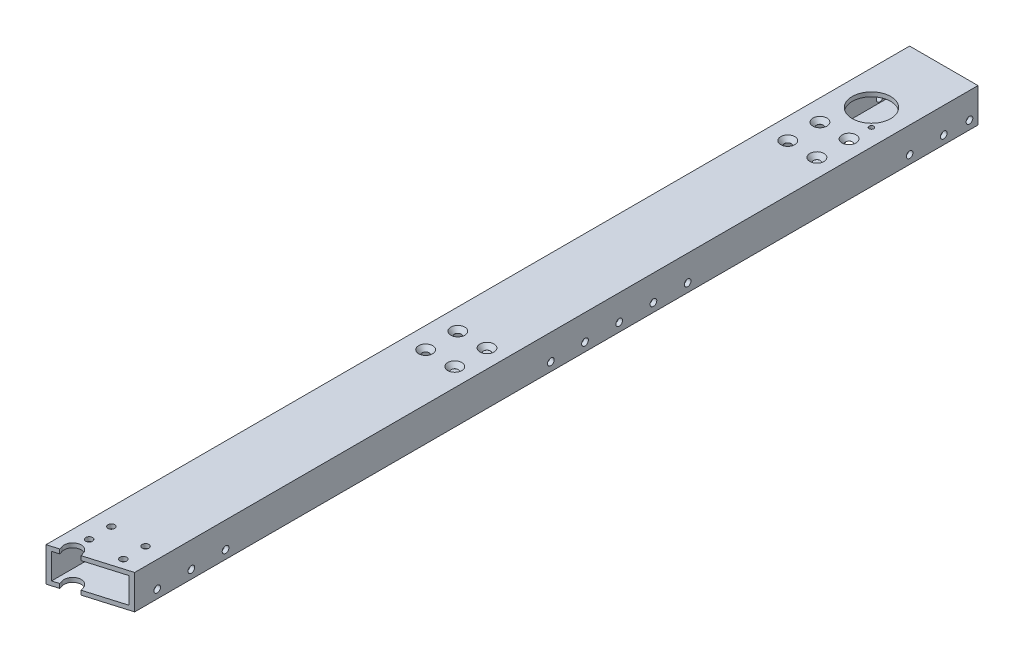
from build123d import *

# Parameters (mm, degrees)
BOSS_EXTRUDE1_DEPTH              = 320.675
BOSS_EXTRUDE1_DEPTH_BACK         = 320.675
SKETCH3_W                        = 50.8
SKETCH3_H                        = 25.4
SKETCH3_W_2                      = 44.45
SKETCH3_H_2                      = 19.05
CUT_EXTRUDE1_DEPTH               = 323.680609311
CUT_EXTRUDE1_DEPTH_BACK          = 323.680609311
SKETCH8_R                        = 14.2875
CUT_EXTRUDE2_DEPTH               = 323.680609311
F_10_CLEARANCE_HOLE1_D           = 4.9784
F_10_CLEARANCE_HOLE1_DEPTH       = 5.08
F_10_CLEARANCE_HOLE1_TIP         = 1.495662253
F_10_CLEARANCE_HOLE2_D           = 4.9784
F_10_CLEARANCE_HOLE3_D           = 4.9784
TAP_DRILL_FOR_8_32_TAP1_D        = 3.4544
F_10_CLEARANCE_HOLE4_AT_2_COUNT  = 2
F_10_CLEARANCE_HOLE4_AT_2_PITCH  = 21.6408
F_10_CLEARANCE_HOLE4_AT_3_COUNT  = 2
F_10_CLEARANCE_HOLE4_AT_3_PITCH  = 32.224022105
F_10_CLEARANCE_HOLE4_AT_4_COUNT  = 2
F_10_CLEARANCE_HOLE4_AT_4_PITCH  = 23.876
F_10_CLEARANCE_HOLE4_AT_5_COUNT  = 2
F_10_CLEARANCE_HOLE4_AT_5_PITCH  = 245.0465
F_10_CLEARANCE_HOLE4_AT_6_COUNT  = 2
F_10_CLEARANCE_HOLE4_AT_6_PITCH  = 246.000226396
F_10_CLEARANCE_HOLE4_AT_7_COUNT  = 2
F_10_CLEARANCE_HOLE4_AT_7_PITCH  = 268.9225
F_10_CLEARANCE_HOLE4_AT_8_COUNT  = 2
F_10_CLEARANCE_HOLE4_AT_8_PITCH  = 269.79183685
F_10_0_1935_DIAMETER_HOLE1_D     = 4.9149
F_10_0_1935_DIAMETER_HOLE1_DEPTH = 3.302
F_10_0_1935_DIAMETER_HOLE1_TIP   = 1.476584928
CUT_EXTRUDE3_DEPTH               = 323.680609311


with BuildPart() as part:
    # Sketch3 → Boss-Extrude1 (new, two sides: drawn at the far end of the back side and taken through both)
    with BuildSketch(Plane.XY.offset(-BOSS_EXTRUDE1_DEPTH_BACK)):
        Rectangle(SKETCH3_W, SKETCH3_H)
        Rectangle(SKETCH3_W_2, SKETCH3_H_2, mode=Mode.SUBTRACT)
    extrude(amount=BOSS_EXTRUDE1_DEPTH + BOSS_EXTRUDE1_DEPTH_BACK)

    # Sketch4 → Cut-Extrude1 (cut, two sides: drawn at the far end of the back side and taken through both)
    with BuildSketch(Plane(origin=(0, 12.7, 0), x_dir=(1, 0, 0), z_dir=(0, 1, 0)).offset(-CUT_EXTRUDE1_DEPTH_BACK)):
        Polygon((1322.117470931, -320.675), (25.4, -320.675), (-25.4, -320.675), (25.4, -305.627354456), (1268.718301677, 62.660305034), (3837.350959621, 420.474595165), (3890.750128875, 37.139290131), align=None)
    extrude(amount=CUT_EXTRUDE1_DEPTH + CUT_EXTRUDE1_DEPTH_BACK, mode=Mode.SUBTRACT)

    # Sketch8 → Cut-Extrude2 (cut, through all)
    with BuildSketch(Plane(origin=(0, 12.7, 0), x_dir=(1, 0, 0), z_dir=(0, 1, 0))):
        with Locations(Location((0, 266.954, 0), (0, 0, 180))):
            Circle(SKETCH8_R)
    extrude(amount=-CUT_EXTRUDE2_DEPTH, mode=Mode.SUBTRACT)

    # #10 Clearance Hole1
    with Locations(Plane(origin=(0, 12.7, 0), x_dir=(1, 0, 0), z_dir=(0, 1, 0))):
        with Locations((-12.7762, -284.753033923), (12.6238, -284.753033923), (12.6238, -301.263033923), (-12.7762, -301.263033923)):
            Hole(F_10_CLEARANCE_HOLE1_D / 2, depth=F_10_CLEARANCE_HOLE1_DEPTH)
            with Locations((0, 0, -(F_10_CLEARANCE_HOLE1_DEPTH + F_10_CLEARANCE_HOLE1_TIP / 2))):  # 118° drill point
                Cone(0, F_10_CLEARANCE_HOLE1_D / 2, F_10_CLEARANCE_HOLE1_TIP, mode=Mode.SUBTRACT)

    # #10 Clearance Hole2 (through all)
    with Locations(Plane(origin=(25.4, 0, 0), x_dir=(0, 0, -1), z_dir=(1, 0, 0))):
        with Locations((3.429, -6.35), (28.829, -6.35), (54.229, -6.35), (79.629, -6.35), (105.029, -6.35), (-288.925, -6.35), (-263.525, -6.35), (-238.126133061, -6.35)):
            Hole(F_10_CLEARANCE_HOLE2_D / 2)

    # #10 Clearance Hole3 (through all)
    with Locations(Plane(origin=(25.4, 0, 0), x_dir=(0, 0, -1), z_dir=(1, 0, 0))):
        with Locations((295.275, -6.388229415), (314.325, -6.35)):
            Hole(F_10_CLEARANCE_HOLE3_D / 2)

    # Tap Drill for #8-32 Tap1 (through all)
    with Locations(Plane(origin=(0, -12.7, 0), x_dir=(-1, 0, 0), z_dir=(0, -1, 0))):
        with Locations((-12.751963692, 254.202036308)):
            Hole(TAP_DRILL_FOR_8_32_TAP1_D / 2)

    # Sketch21 → #10 Clearance Hole4 (revolve, cut)
    with BuildSketch(Plane(origin=(11.845144988, -12.7, 30.44825), x_dir=(0, 0, -1), z_dir=(1, 0, 0))):
        Polygon((0, 0), (0, 25.4), (5.2197, 25.4), (2.4892, 22.258919064), (2.4892, 0), align=None)
    f_10_clearance_hole4 = revolve(axis=Axis((11.845144988, -19.05, 30.44825), (0, 1, 0)), mode=Mode.SUBTRACT)

    # #10 Clearance Hole4 at 2: #10 Clearance Hole4 ×2
    with Locations(*[(-i * F_10_CLEARANCE_HOLE4_AT_2_PITCH, 0, 0) for i in range(1, F_10_CLEARANCE_HOLE4_AT_2_COUNT)]):
        add(f_10_clearance_hole4, mode=Mode.SUBTRACT)

    # #10 Clearance Hole4 at 3: #10 Clearance Hole4 ×2
    with Locations(*[Vector(-0.6715735214342001, 0, 0.7409379227090944) * (i * F_10_CLEARANCE_HOLE4_AT_3_PITCH) for i in range(1, F_10_CLEARANCE_HOLE4_AT_3_COUNT)]):
        add(f_10_clearance_hole4, mode=Mode.SUBTRACT)

    # #10 Clearance Hole4 at 4: #10 Clearance Hole4 ×2
    with Locations(*[(0, 0, i * F_10_CLEARANCE_HOLE4_AT_4_PITCH) for i in range(1, F_10_CLEARANCE_HOLE4_AT_4_COUNT)]):
        add(f_10_clearance_hole4, mode=Mode.SUBTRACT)

    # #10 Clearance Hole4 at 5: #10 Clearance Hole4 ×2
    with Locations(*[(0, 0, -i * F_10_CLEARANCE_HOLE4_AT_5_PITCH) for i in range(1, F_10_CLEARANCE_HOLE4_AT_5_COUNT)]):
        add(f_10_clearance_hole4, mode=Mode.SUBTRACT)

    # #10 Clearance Hole4 at 6: #10 Clearance Hole4 ×2
    with Locations(*[Vector(-0.08797065074713521, 0, -0.9961230669988149) * (i * F_10_CLEARANCE_HOLE4_AT_6_PITCH) for i in range(1, F_10_CLEARANCE_HOLE4_AT_6_COUNT)]):
        add(f_10_clearance_hole4, mode=Mode.SUBTRACT)

    # #10 Clearance Hole4 at 7: #10 Clearance Hole4 ×2
    with Locations(*[(0, 0, -i * F_10_CLEARANCE_HOLE4_AT_7_PITCH) for i in range(1, F_10_CLEARANCE_HOLE4_AT_7_COUNT)]):
        add(f_10_clearance_hole4, mode=Mode.SUBTRACT)

    # #10 Clearance Hole4 at 8: #10 Clearance Hole4 ×2
    with Locations(*[Vector(-0.08021295326304817, 0, -0.9967777496156403) * (i * F_10_CLEARANCE_HOLE4_AT_8_PITCH) for i in range(1, F_10_CLEARANCE_HOLE4_AT_8_COUNT)]):
        add(f_10_clearance_hole4, mode=Mode.SUBTRACT)

    # #10 (0.1935) Diameter Hole1
    with Locations(Plane(origin=(25.4, 0, 0), x_dir=(0, 0, -1), z_dir=(1, 0, 0))):
        with Locations((269.875, -6.35)):
            Hole(F_10_0_1935_DIAMETER_HOLE1_D / 2, depth=F_10_0_1935_DIAMETER_HOLE1_DEPTH)
            with Locations((0, 0, -(F_10_0_1935_DIAMETER_HOLE1_DEPTH + F_10_0_1935_DIAMETER_HOLE1_TIP / 2))):  # 118° drill point
                Cone(0, F_10_0_1935_DIAMETER_HOLE1_D / 2, F_10_0_1935_DIAMETER_HOLE1_TIP, mode=Mode.SUBTRACT)

    # Sketch24 → Cut-Extrude3 (cut, through all)
    with BuildSketch(Plane.XZ.offset(12.7)):
        with BuildLine():
            Line((-5.356640498, 314.737886431), (-17.533651131, 318.344881309))
            Line((-17.533651131, 318.344881309), (-18.255050107, 315.909479182))
            ThreePointArc((-18.255050107, 315.909479182), (-13.970042229, 308.017476427), (-6.078039474, 312.302484305))
            Line((-6.078039474, 312.302484305), (-5.356640498, 314.737886431))
        make_face()
    extrude(amount=-CUT_EXTRUDE3_DEPTH, mode=Mode.SUBTRACT)


solid = part.part
